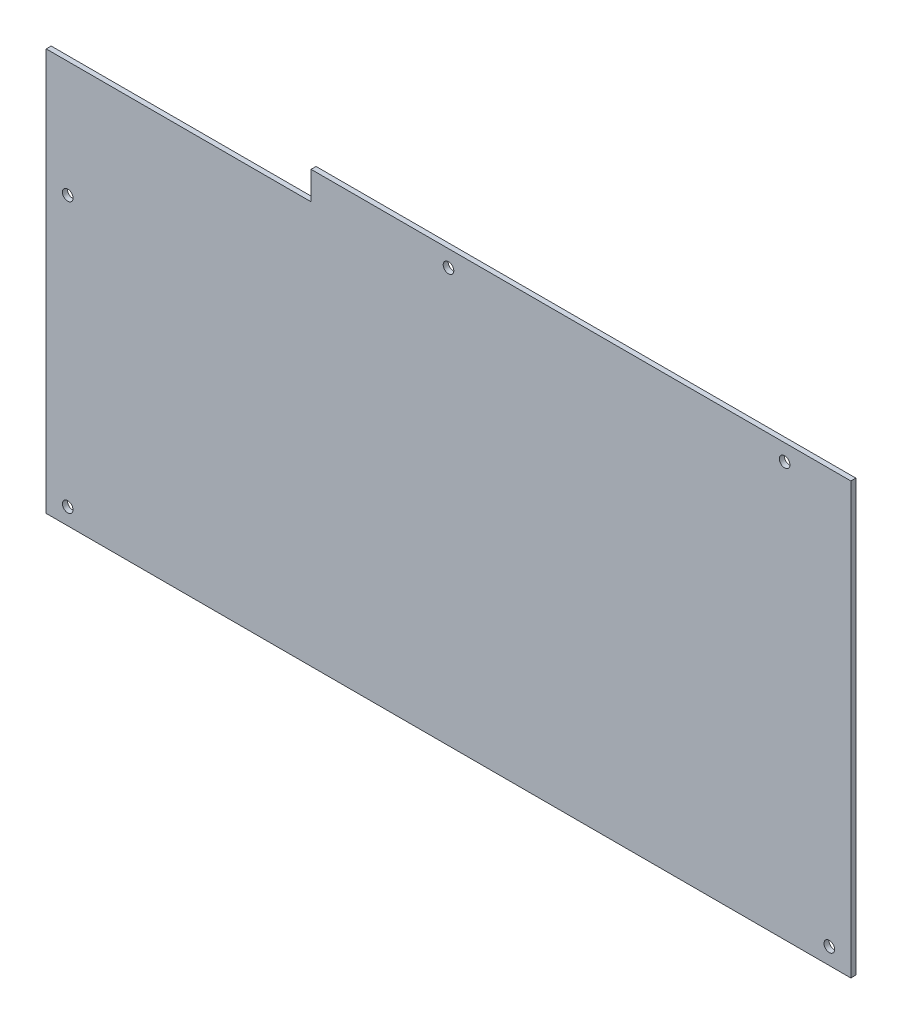
from build123d import *

# Parameters (mm, degrees)
BOSS_EXTRUDE1_DEPTH = 1.5
SKETCH2_R           = 1.6
CUT_EXTRUDE1_DEPTH  = 1.5


with BuildPart() as part:
    # Sketch1 → Boss-Extrude1 (new body)
    with BuildSketch(Plane.XY):
        Polygon((-241.5, -120), (1.5, -120), (1.5, 10), (-161.5, 10), (-161.5, 1.5), (-241.5, 1.5), align=None)
    extrude(amount=BOSS_EXTRUDE1_DEPTH)

    # Sketch2 → Cut-Extrude1 (cut)
    with BuildSketch(Plane.XY.offset(1.5)):
        with Locations((-235, -33.5)):
            Circle(SKETCH2_R)
        with Locations((-235, -115)):
            Circle(SKETCH2_R)
        with Locations((-5, -115)):
            Circle(SKETCH2_R)
        with Locations((-120, 5)):
            Circle(SKETCH2_R)
        with Locations((-18.5, 5)):
            Circle(SKETCH2_R)
    extrude(amount=-CUT_EXTRUDE1_DEPTH, mode=Mode.SUBTRACT)


solid = part.part
